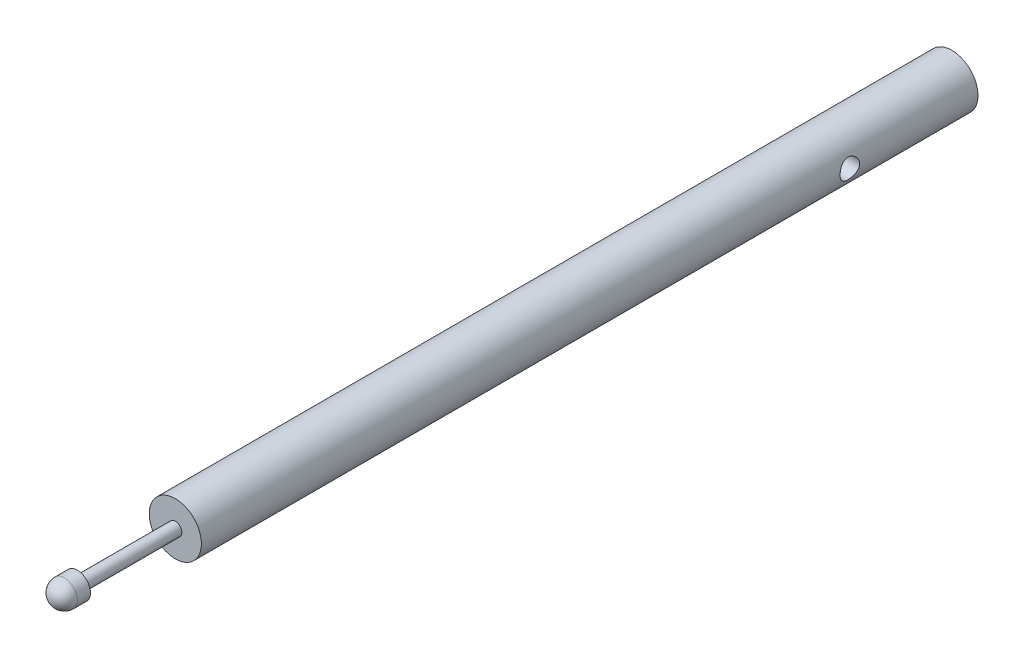
from build123d import *

# Parameters (mm, degrees)
SZKIC1_R                                    = 4
DODANIE_WYCI_GNI_CIE1_DEPTH                 = 119
WYTNIJ_WYCI_GNI_CIE1_REACH                  = 121.134
WYTNIJ_WYCI_GNI_CIE1_END_RADIUS             = 4
SZKIC2_R                                    = 1.5
WYTNIJ_WYCI_GNI_CIE1_DIRECTION_2_REACH      = 121.134
WYTNIJ_WYCI_GNI_CIE1_DIRECTION_2_END_RADIUS = 4
SZKIC3_R                                    = 1
DODANIE_WYCI_GNI_CIE2_DEPTH                 = 15
SZKIC4_R                                    = 2
DODANIE_WYCI_GNI_CIE3_DEPTH                 = 4
ZAOKR_GLENIE1_R                             = 2


with BuildPart() as part:
    # Szkic1 → Dodanie-wyciągnięcie1 (new body)
    with BuildSketch(Plane.XY):
        Circle(SZKIC1_R)
    extrude(amount=DODANIE_WYCI_GNI_CIE1_DEPTH)

    # Wytnij-wyciągnięcie1: up to this cylinder (the profile starts inside it)
    wytnij_wyci_gni_cie1_end = Plane(origin=(0, 0, 19.63585), z_dir=(0, 0, -1)) * Cylinder(WYTNIJ_WYCI_GNI_CIE1_END_RADIUS, 251.268, mode=Mode.PRIVATE)
    # Szkic2 → Wytnij-wyciągnięcie1 (cut, up to the surface)
    with BuildSketch(Plane(origin=(0, 0, 0), x_dir=(0, 0, -1), z_dir=(1, 0, 0)), mode=Mode.PRIVATE) as wytnij_wyci_gni_cie1_sk1:
        with Locations((-19.635850317, 0)):
            Circle(SZKIC2_R)
    wytnij_wyci_gni_cie1_tool1 = extrude(wytnij_wyci_gni_cie1_sk1.sketch, amount=-WYTNIJ_WYCI_GNI_CIE1_REACH, mode=Mode.PRIVATE) & wytnij_wyci_gni_cie1_end
    add(wytnij_wyci_gni_cie1_tool1.solids().sort_by_distance((0, 0, 19.63585))[0], mode=Mode.SUBTRACT)

    # Wytnij-wyciągnięcie1 direction 2: up to this cylinder (the profile starts inside it)
    wytnij_wyci_gni_cie1_direction_2_end = Plane(origin=(0, 0, 19.63585), z_dir=(0, 0, -1)) * Cylinder(WYTNIJ_WYCI_GNI_CIE1_DIRECTION_2_END_RADIUS, 251.268, mode=Mode.PRIVATE)
    # Szkic2 → Wytnij-wyciągnięcie1 direction 2 (cut, up to the surface)
    with BuildSketch(Plane(origin=(0, 0, 0), x_dir=(0, 0, -1), z_dir=(1, 0, 0)), mode=Mode.PRIVATE) as wytnij_wyci_gni_cie1_direction_2_sk1:
        with Locations((-19.635850317, 0)):
            Circle(SZKIC2_R)
    wytnij_wyci_gni_cie1_direction_2_tool1 = extrude(wytnij_wyci_gni_cie1_direction_2_sk1.sketch, amount=WYTNIJ_WYCI_GNI_CIE1_DIRECTION_2_REACH, mode=Mode.PRIVATE) & wytnij_wyci_gni_cie1_direction_2_end
    add(wytnij_wyci_gni_cie1_direction_2_tool1.solids().sort_by_distance((0, 0, 19.63585))[0], mode=Mode.SUBTRACT)

    # Szkic3 → Dodanie-wyciągnięcie2 (add)
    with BuildSketch(Plane.XY.offset(119)):
        Circle(SZKIC3_R)
    extrude(amount=DODANIE_WYCI_GNI_CIE2_DEPTH)

    # Szkic4 → Dodanie-wyciągnięcie3 (add)
    with BuildSketch(Plane.XY.offset(134)):
        Circle(SZKIC4_R)
    extrude(amount=DODANIE_WYCI_GNI_CIE3_DEPTH)

    # Zaokrąglenie1
    zaokr_glenie1_edges = [part.edges().sort_by_distance(p)[0] for p in [
        (-2, 0, 138),
    ]]
    fillet(zaokr_glenie1_edges, radius=ZAOKR_GLENIE1_R)


solid = part.part
